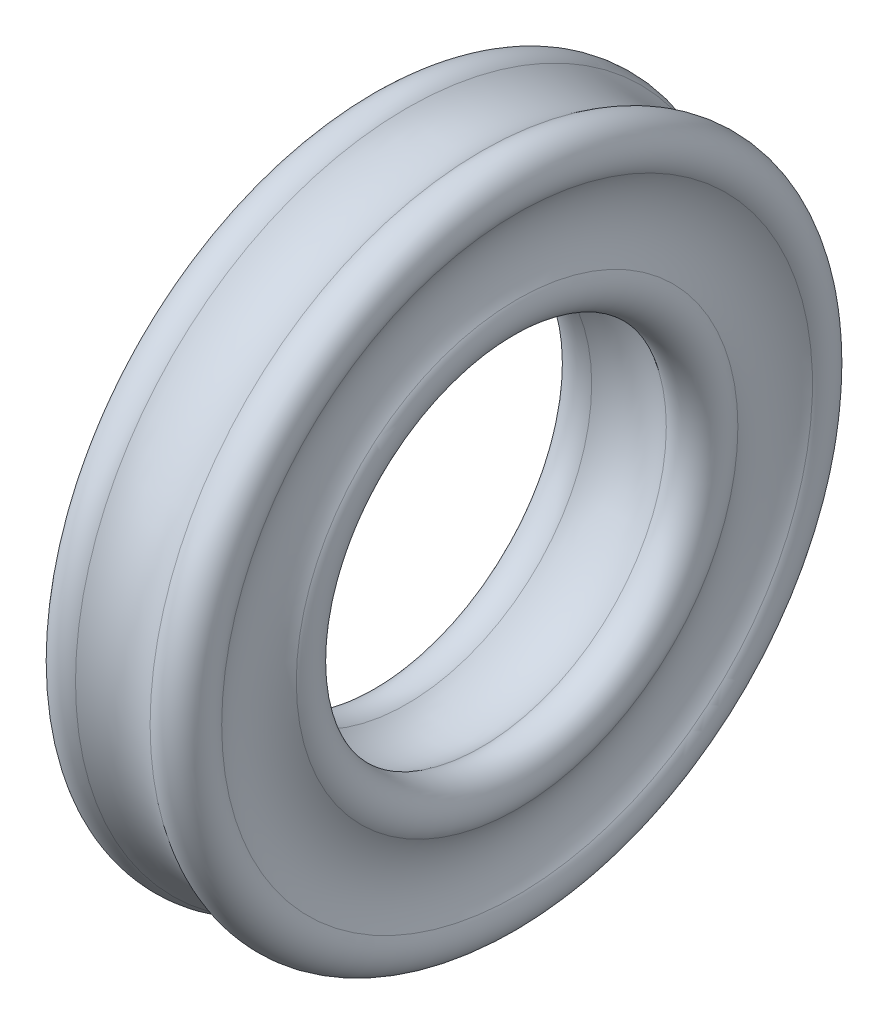
from build123d import *


with BuildPart() as part:
    # 草圖1 → 旋轉1 (revolve)
    with BuildSketch(Plane.XY, mode=Mode.PRIVATE) as revolve_1_sk:
        with BuildLine():
            ThreePointArc((56.641005887, 228.905996075), (47.888974491, 200), (56.641005887, 171.094003925))
            ThreePointArc((56.641005887, 171.094003925), (54.142135624, 145.857864376), (28.905996075, 143.358994113))
            ThreePointArc((28.905996075, 143.358994113), (0, 152.111025509), (-28.905996075, 143.358994113))
            ThreePointArc((-28.905996075, 143.358994113), (-54.142135624, 145.857864376), (-56.641005887, 171.094003925))
            ThreePointArc((-56.641005887, 171.094003925), (-47.888974491, 200), (-56.641005887, 228.905996075))
            ThreePointArc((-56.641005887, 228.905996075), (-54.142135624, 254.142135624), (-28.905996075, 256.641005887))
            ThreePointArc((-28.905996075, 256.641005887), (0, 247.888974491), (28.905996075, 256.641005887))
            ThreePointArc((28.905996075, 256.641005887), (54.142135624, 254.142135624), (56.641005887, 228.905996075))
        make_face()
    revolve(revolve_1_sk.sketch.rotate(Axis((0, 0, 0), (1, 0, 0)), 90), axis=Axis((0, 0, 0), (1, 0, 0)))


solid = part.part
